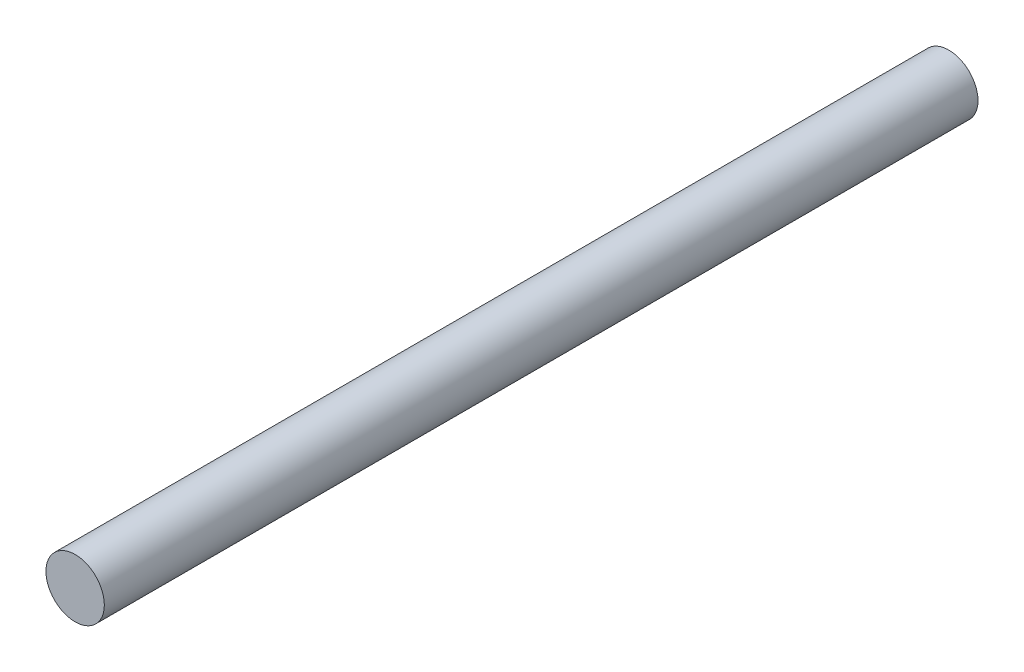
from build123d import *

# Parameters (mm, degrees)
SKETCH1_R           = 6.35
BOSS_EXTRUDE1_DEPTH = 190


with BuildPart() as part:
    # Sketch1 → Boss-Extrude1 (new body)
    with BuildSketch(Plane.XY):
        Circle(SKETCH1_R)
    extrude(amount=-BOSS_EXTRUDE1_DEPTH)


solid = part.part
